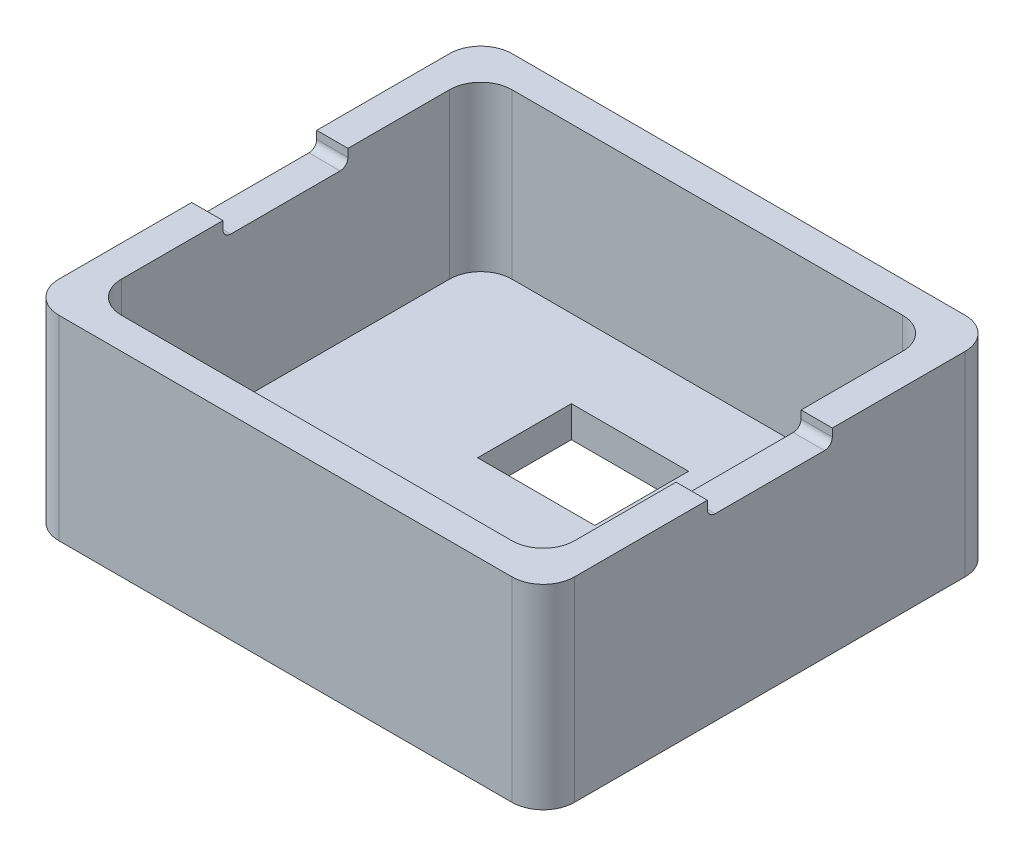
from build123d import *

# Parameters (mm, degrees)
SKETCH1_W            = 33
SKETCH1_H            = 29
BOSS_EXTRUDE1_DEPTH  = 2
SKETCH2_W            = 33
SKETCH2_H            = 29
SKETCH2_W_2          = 29
SKETCH2_H_2          = 25
BOSS_EXTRUDE2_DEPTH  = 10.5
SKETCH4_W            = 7.5
SKETCH4_H            = 6
CUT_EXTRUDE1_DEPTH   = 2
FILLET1_R            = 2
SKETCH5_W            = 8
SKETCH5_H            = 1
CUT_EXTRUDE2_DEPTH   = 31
FILLET2_R            = 0.5
FILLET2_OF_MIRROR1_R = 0.5


with BuildPart() as part:
    # Sketch1 → Boss-Extrude1 (new body)
    with BuildSketch(Plane(origin=(0, 0, 0), x_dir=(1, 0, 0), z_dir=(0, 1, 0))):
        Rectangle(SKETCH1_W, SKETCH1_H)
    extrude(amount=BOSS_EXTRUDE1_DEPTH)

    # Sketch2 → Boss-Extrude2 (add)
    with BuildSketch(Plane(origin=(0, 2, 0), x_dir=(1, 0, 0), z_dir=(0, 1, 0))):
        Rectangle(SKETCH2_W, SKETCH2_H)
        Rectangle(SKETCH2_W_2, SKETCH2_H_2, mode=Mode.SUBTRACT)
    extrude(amount=BOSS_EXTRUDE2_DEPTH)

    # Sketch4 → Cut-Extrude1 (cut)
    with BuildSketch(Plane(origin=(0, 2, 0), x_dir=(1, 0, 0), z_dir=(0, 1, 0))):
        with Locations((0.05, 4.5)):
            Rectangle(SKETCH4_W, SKETCH4_H)
    extrude(amount=-CUT_EXTRUDE1_DEPTH, mode=Mode.SUBTRACT)

    # Fillet1
    fillet1_edges = [part.edges().sort_by_distance(p)[0] for p in [
        (14.5, 7.25, -12.5),
        (-14.5, 7.25, -12.5),
        (-14.5, 7.25, 12.5),
        (14.5, 7.25, 12.5),
        (16.5, 6.25, 14.5),
        (-16.5, 6.25, 14.5),
        (-16.5, 6.25, -14.5),
        (16.5, 6.25, -14.5),
    ]]
    fillet(fillet1_edges, radius=FILLET1_R)

    # Sketch5 → Cut-Extrude2 (cut)
    with BuildSketch(Plane(origin=(16.5, 0, 0), x_dir=(0, 0, -1), z_dir=(1, 0, 0))):
        with Locations((0, 12)):
            Rectangle(SKETCH5_W, SKETCH5_H)
    cut_extrude2 = extrude(amount=-CUT_EXTRUDE2_DEPTH, mode=Mode.SUBTRACT)

    # Fillet2
    fillet2_edges = [part.edges().sort_by_distance(p)[0] for p in [
        (15.5, 11.5, 4),
        (15.5, 11.5, -4),
    ]]
    fillet(fillet2_edges, radius=FILLET2_R)

    # Mirror1: Cut-Extrude2 across plane
    add(cut_extrude2.mirror(Plane(origin=(0, 0, 0), x_dir=(0, 0, 1), z_dir=(1, 0, 0))), mode=Mode.SUBTRACT)

    # Fillet2 of Mirror1
    fillet2_of_mirror1_edges = [part.edges().sort_by_distance(p)[0] for p in [
        (-15.5, 11.5, 4),
        (-15.5, 11.5, -4),
    ]]
    fillet(fillet2_of_mirror1_edges, radius=FILLET2_OF_MIRROR1_R)


solid = part.part
